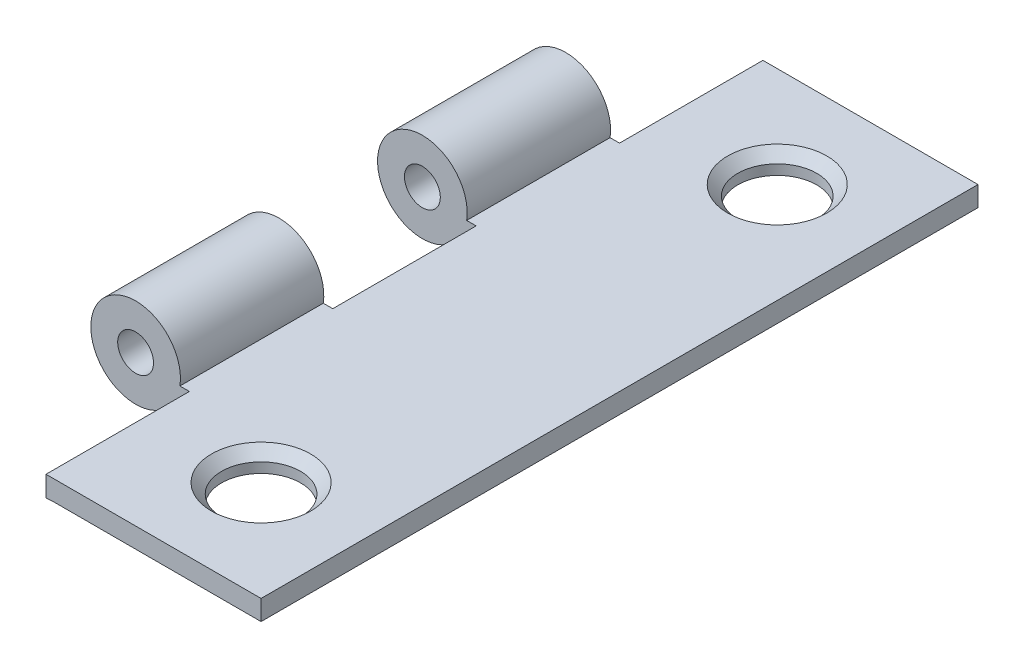
from build123d import *

# Parameters (mm, degrees)
SKETCH4_R               = 3.175
BOSS_EXTRUDE2_DEPTH     = 25.4
FILLET1_R               = 5.08
M5_CLEARANCE_HOLE1_D    = 5.6
CUT_EXTRUDE1_DEPTH      = 32.908355123
CUT_EXTRUDE1_DEPTH_BACK = 32.908355123
SKETCH9_W               = 6.985
SKETCH9_H               = 10.16
SKETCH10_R              = 1.27
CUT_EXTRUDE2_DEPTH      = 55.347245805
CHAMFER1_SIZE           = 0.7112


with BuildPart() as part:
    # Sketch4 → Boss-Extrude2 (new, symmetric)
    with BuildSketch(Plane.XY):
        Circle(SKETCH4_R)
        with BuildLine():
            Line((19.050000043, -1.905), (19.050000043, -0.4826))
            Line((19.050000043, -0.4826), (3.138108067, -0.4826))
            ThreePointArc((3.138108067, -0.4826), (2.926778646, -1.230687513), (2.54, -1.905))
            Line((2.54, -1.905), (19.050000043, -1.905))
        make_face()
    extrude(amount=BOSS_EXTRUDE2_DEPTH, both=True)

    # Fillet1
    fillet1_edges = [part.edges().sort_by_distance(p)[0] for p in [
        (2.54, -1.905, 0),
    ]]
    fillet(fillet1_edges, radius=FILLET1_R)

    # M5 Clearance Hole1 (through all)
    with Locations(Plane(origin=(0, -0.4826, 0), x_dir=(1, 0, 0), z_dir=(0, 1, 0))):
        with Locations((11.938000043, 18.288), (11.938000043, -18.288)):
            Hole(M5_CLEARANCE_HOLE1_D / 2)

    # Sketch9 → Cut-Extrude1 (cut, two sides: drawn at the far end of the back side and taken through both)
    with BuildSketch(Plane(origin=(0, 0, 0), x_dir=(1, 0, 0), z_dir=(0, 1, 0)).offset(-CUT_EXTRUDE1_DEPTH_BACK)):
        with Locations((0.3175, -20.32)):
            Rectangle(SKETCH9_W, SKETCH9_H)
        with Locations((0.3175, 0)):
            Rectangle(SKETCH9_W, SKETCH9_H)
        with Locations((0.3175, 20.32)):
            Rectangle(SKETCH9_W, SKETCH9_H)
    extrude(amount=CUT_EXTRUDE1_DEPTH + CUT_EXTRUDE1_DEPTH_BACK, mode=Mode.SUBTRACT)

    # Sketch10 → Cut-Extrude2 (cut, through all)
    with BuildSketch(Plane.XY.offset(25.4)):
        Circle(SKETCH10_R)
    extrude(amount=-CUT_EXTRUDE2_DEPTH, mode=Mode.SUBTRACT)

    # Chamfer1
    chamfer1_edges = [part.edges().sort_by_distance(p)[0] for p in [
        (14.738000043, -0.4826, 18.288),
        (14.738000043, -0.4826, -18.288),
    ]]
    chamfer(chamfer1_edges, length=CHAMFER1_SIZE)


solid = part.part
